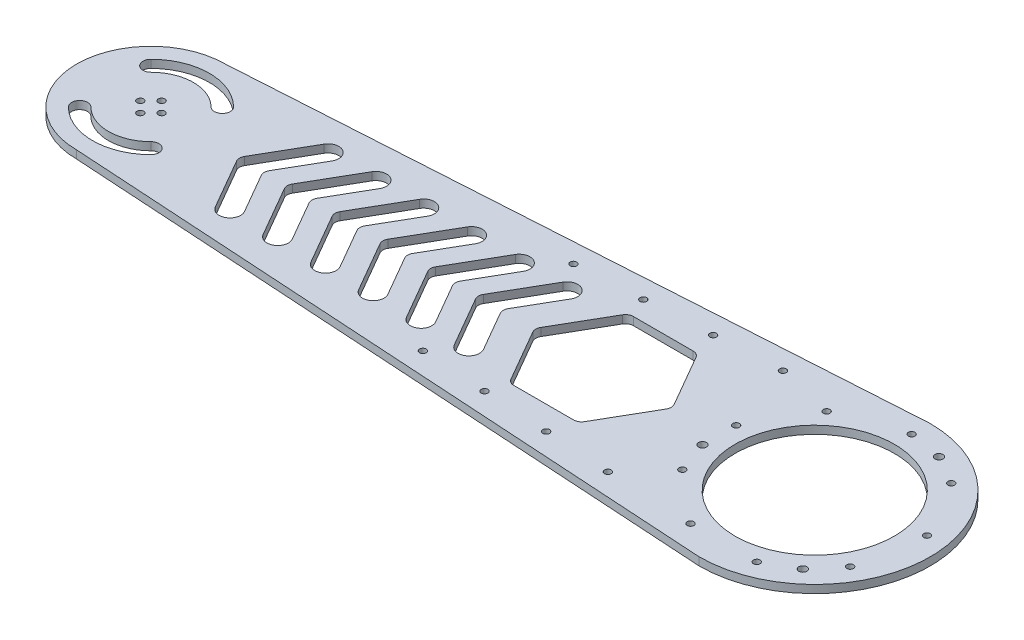
from build123d import *

# Parameters (mm, degrees)
EXTRUDE_1_DEPTH     = 3
SKETCH_3_R          = 1.25
SKETCH_3_R_2        = 30
SKETCH_3_R_3        = 1.5
CUT_EXTRUDE_1_DEPTH = 3
CUT_EXTRUDE_2_DEPTH = 3
SKETCH_5_R          = 1.25
CUT_EXTRUDE_3_DEPTH = 10


with BuildPart() as part:
    # 草图2 → 凸台-拉伸1 (new body)
    with BuildSketch(Plane(origin=(0, 5, 0), x_dir=(1, 0, 0), z_dir=(0, 1, 0))):
        with BuildLine():
            Line((-250, 28), (0, 43.5))
            ThreePointArc((0, 43.5), (43.5, 0), (0, -43.5))
            Line((0, -43.5), (-250, -28))
            ThreePointArc((-250, -28), (-278, 0), (-250, 28))
        make_face()
    extrude(amount=EXTRUDE_1_DEPTH)

    # 草图3 → 切除-拉伸1 (cut)
    with BuildSketch(Plane(origin=(0, 8, 0), x_dir=(1, 0, 0), z_dir=(0, 1, 0))):
        with Locations(Location((-250, 4, 0), (0, 0, 270))):
            Circle(SKETCH_3_R)
        with Locations(Location((-246, 0, 0), (0, 0, 270))):
            Circle(SKETCH_3_R)
        with Locations(Location((-250, -4, 0), (0, 0, 270))):
            Circle(SKETCH_3_R)
        with Locations(Location((-254, 0, 0), (0, 0, 270))):
            Circle(SKETCH_3_R)
        with Locations(Location((0, 0, 0), (0, 0, 270))):
            Circle(SKETCH_3_R_2)
        with Locations(Location((0, 36.5, 0), (0, 0, 270))):
            Circle(SKETCH_3_R)
        with Locations(Location((12.483735231, 34.298780659, 0), (0, 0, 270))):
            Circle(SKETCH_3_R_3)
        with Locations(Location((23.461747754, 27.960622174, 0), (0, 0, 270))):
            Circle(SKETCH_3_R)
        with Locations(Location((-23.461747754, 27.960622174, 0), (0, 0, 270))):
            Circle(SKETCH_3_R)
        with Locations(Location((-35.945482985, 6.338158485, 0), (0, 0, 270))):
            Circle(SKETCH_3_R)
        with Locations(Location((-35.945482985, -6.338158485, 0), (0, 0, 270))):
            Circle(SKETCH_3_R_3)
        with Locations(Location((-31.609927238, -18.25, 0), (0, 0, 270))):
            Circle(SKETCH_3_R)
        with Locations(Location((-12.483735231, -34.298780659, 0), (0, 0, 270))):
            Circle(SKETCH_3_R)
        with Locations(Location((12.483735231, -34.298780659, 0), (0, 0, 270))):
            Circle(SKETCH_3_R)
        with Locations(Location((23.461747754, -27.960622174, 0), (0, 0, 270))):
            Circle(SKETCH_3_R_3)
        with Locations(Location((31.609927238, -18.25, 0), (0, 0, 270))):
            Circle(SKETCH_3_R)
        with Locations(Location((35.945482985, 6.338158485, 0), (0, 0, 270))):
            Circle(SKETCH_3_R)
        with BuildLine():
            ThreePointArc((-265.553651429, 15.553651429), (-265.553651429, 11.316406256), (-261.316406256, 11.316406256))
            ThreePointArc((-261.316406256, 11.316406256), (-250, 16.003815204), (-238.683593744, 11.316406256))
            ThreePointArc((-238.683593744, 11.316406256), (-234.446348571, 11.316406256), (-234.446348571, 15.553651429))
            ThreePointArc((-234.446348571, 15.553651429), (-250, 21.996184796), (-265.553651429, 15.553651429))
        make_face()
        with BuildLine():
            ThreePointArc((-261.316406256, -11.316406256), (-250, -16.003815204), (-238.683593744, -11.316406256))
            ThreePointArc((-238.683593744, -11.316406256), (-234.446348571, -11.316406256), (-234.446348571, -15.553651429))
            ThreePointArc((-234.446348571, -15.553651429), (-250, -21.996184796), (-265.553651429, -15.553651429))
            ThreePointArc((-265.553651429, -15.553651429), (-265.553651429, -11.316406256), (-261.316406256, -11.316406256))
        make_face()
    extrude(amount=-CUT_EXTRUDE_1_DEPTH, mode=Mode.SUBTRACT)

    # 草图4 → 切除-拉伸2 (cut)
    with BuildSketch(Plane(origin=(0, 8, 0), x_dir=(1, 0, 0), z_dir=(0, 1, 0))):
        with BuildLine():
            Line((-216.23889617, 1.5), (-205.267472927, 20.503062488))
            ThreePointArc((-205.267472927, 20.503062488), (-199.762485666, 21.978119379), (-198.287428775, 16.473132117))
            Line((-198.287428775, 16.473132117), (-206.932170633, 1.5))
            ThreePointArc((-206.932170633, 1.5), (-207.334094422, 0), (-206.932170633, -1.5))
            Line((-206.932170633, -1.5), (-198.287428775, -16.473132117))
            ThreePointArc((-198.287428775, -16.473132117), (-199.762485666, -21.978119379), (-205.267472927, -20.503062488))
            Line((-205.267472927, -20.503062488), (-216.23889617, -1.5))
            ThreePointArc((-216.23889617, -1.5), (-216.640819958, 0), (-216.23889617, 1.5))
        make_face()
        with BuildLine():
            Line((-54.444025551, 1.5), (-65.7023558, 21))
            ThreePointArc((-65.7023558, 21), (-66.800432012, 22.098076211), (-68.300432012, 22.5))
            Line((-68.300432012, 22.5), (-90.81709251, 22.5))
            ThreePointArc((-90.81709251, 22.5), (-92.31709251, 22.098076211), (-93.415168722, 21))
            Line((-93.415168722, 21), (-104.673498971, 1.5))
            ThreePointArc((-104.673498971, 1.5), (-105.075422759, 0), (-104.673498971, -1.5))
            Line((-104.673498971, -1.5), (-93.415168722, -21))
            ThreePointArc((-93.415168722, -21), (-92.31709251, -22.098076211), (-90.81709251, -22.5))
            Line((-90.81709251, -22.5), (-68.300432012, -22.5))
            ThreePointArc((-68.300432012, -22.5), (-66.800432012, -22.098076211), (-65.7023558, -21))
            Line((-65.7023558, -21), (-54.444025551, -1.5))
            ThreePointArc((-54.444025551, -1.5), (-54.042101763, 0), (-54.444025551, 1.5))
        make_face()
        with BuildLine():
            Line((-188.932170633, -1.5), (-180.287428775, -16.473132117))
            ThreePointArc((-180.287428775, -16.473132117), (-181.762485666, -21.978119379), (-187.267472927, -20.503062488))
            Line((-187.267472927, -20.503062488), (-198.23889617, -1.5))
            ThreePointArc((-198.23889617, -1.5), (-198.640819958, 0), (-198.23889617, 1.5))
            Line((-198.23889617, 1.5), (-187.267472927, 20.503062488))
            ThreePointArc((-187.267472927, 20.503062488), (-181.762485666, 21.978119379), (-180.287428775, 16.473132117))
            Line((-180.287428775, 16.473132117), (-188.932170633, 1.5))
            ThreePointArc((-188.932170633, 1.5), (-189.334094422, 0), (-188.932170633, -1.5))
        make_face()
        with BuildLine():
            Line((-170.932170633, -1.5), (-162.287428775, -16.473132117))
            ThreePointArc((-162.287428775, -16.473132117), (-163.762485666, -21.978119379), (-169.267472927, -20.503062488))
            Line((-169.267472927, -20.503062488), (-180.23889617, -1.5))
            ThreePointArc((-180.23889617, -1.5), (-180.640819958, 0), (-180.23889617, 1.5))
            Line((-180.23889617, 1.5), (-169.267472927, 20.503062488))
            ThreePointArc((-169.267472927, 20.503062488), (-163.762485666, 21.978119379), (-162.287428775, 16.473132117))
            Line((-162.287428775, 16.473132117), (-170.932170633, 1.5))
            ThreePointArc((-170.932170633, 1.5), (-171.334094422, 0), (-170.932170633, -1.5))
        make_face()
        with BuildLine():
            Line((-152.932170633, -1.5), (-144.287428775, -16.473132117))
            ThreePointArc((-144.287428775, -16.473132117), (-145.762485666, -21.978119379), (-151.267472927, -20.503062488))
            Line((-151.267472927, -20.503062488), (-162.23889617, -1.5))
            ThreePointArc((-162.23889617, -1.5), (-162.640819958, 0), (-162.23889617, 1.5))
            Line((-162.23889617, 1.5), (-151.267472927, 20.503062488))
            ThreePointArc((-151.267472927, 20.503062488), (-145.762485666, 21.978119379), (-144.287428775, 16.473132117))
            Line((-144.287428775, 16.473132117), (-152.932170633, 1.5))
            ThreePointArc((-152.932170633, 1.5), (-153.334094422, 0), (-152.932170633, -1.5))
        make_face()
        with BuildLine():
            Line((-134.932170633, -1.5), (-126.287428775, -16.473132117))
            ThreePointArc((-126.287428775, -16.473132117), (-127.762485666, -21.978119379), (-133.267472927, -20.503062488))
            Line((-133.267472927, -20.503062488), (-144.23889617, -1.5))
            ThreePointArc((-144.23889617, -1.5), (-144.640819958, 0), (-144.23889617, 1.5))
            Line((-144.23889617, 1.5), (-133.267472927, 20.503062488))
            ThreePointArc((-133.267472927, 20.503062488), (-127.762485666, 21.978119379), (-126.287428775, 16.473132117))
            Line((-126.287428775, 16.473132117), (-134.932170633, 1.5))
            ThreePointArc((-134.932170633, 1.5), (-135.334094422, 0), (-134.932170633, -1.5))
        make_face()
        with BuildLine():
            Line((-116.932170633, -1.5), (-108.287428775, -16.473132117))
            ThreePointArc((-108.287428775, -16.473132117), (-109.762485666, -21.978119379), (-115.267472927, -20.503062488))
            Line((-115.267472927, -20.503062488), (-126.23889617, -1.5))
            ThreePointArc((-126.23889617, -1.5), (-126.640819958, 0), (-126.23889617, 1.5))
            Line((-126.23889617, 1.5), (-115.267472927, 20.503062488))
            ThreePointArc((-115.267472927, 20.503062488), (-109.762485666, 21.978119379), (-108.287428775, 16.473132117))
            Line((-108.287428775, 16.473132117), (-116.932170633, 1.5))
            ThreePointArc((-116.932170633, 1.5), (-117.334094422, 0), (-116.932170633, -1.5))
        make_face()
    extrude(amount=-CUT_EXTRUDE_2_DEPTH, mode=Mode.SUBTRACT)

    # 草图5 → 切除-拉伸3 (cut)
    with BuildSketch(Plane(origin=(0, 8, 0), x_dir=(1, 0, 0), z_dir=(0, 1, 0))):
        with Locations(Location((-44.941689831, 32.96361523, 0), (0, 0, 270))):
            Circle(SKETCH_5_R)
        with Locations(Location((-69.702891128, 31.42842075, 0), (0, 0, 270))):
            Circle(SKETCH_5_R)
        with Locations(Location((-119.225293723, 28.358031789, 0), (0, 0, 270))):
            Circle(SKETCH_5_R)
        with Locations(Location((-94.464092426, 29.89322627, 0), (0, 0, 270))):
            Circle(SKETCH_5_R)
        with Locations(Location((-44.941689831, -32.96361523, 0), (0, 0, 270))):
            Circle(SKETCH_5_R)
        with Locations(Location((-69.702891128, -31.42842075, 0), (0, 0, 270))):
            Circle(SKETCH_5_R)
        with Locations(Location((-94.464092426, -29.89322627, 0), (0, 0, 270))):
            Circle(SKETCH_5_R)
        with Locations(Location((-119.225293723, -28.358031789, 0), (0, 0, 270))):
            Circle(SKETCH_5_R)
    extrude(amount=-CUT_EXTRUDE_3_DEPTH, mode=Mode.SUBTRACT)


solid = part.part
